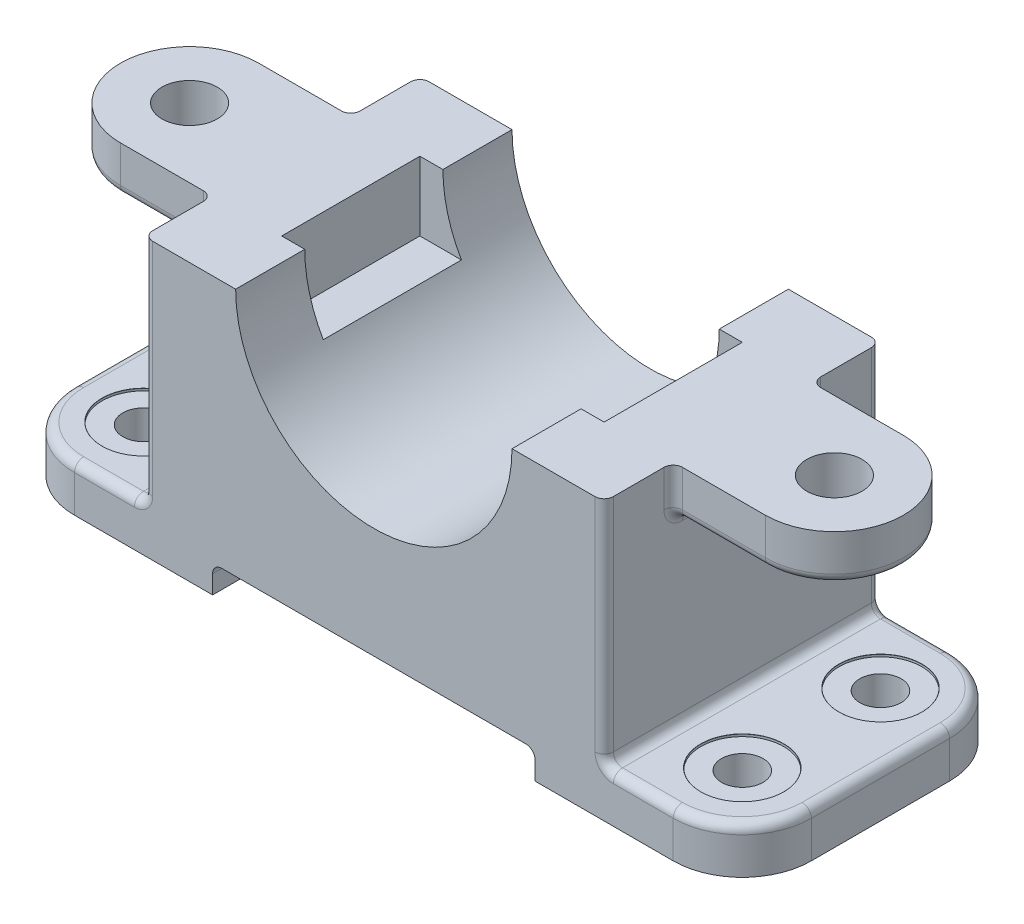
from build123d import *

# Parameters (mm, degrees)
EXTRUDE_1_DEPTH             = 60
SKETCH_2_R                  = 6
EXTRUDE_2_DEPTH             = 10
FILLET_1_R                  = 15
HOLE_WIZARD_M8_1_AT_2_COUNT = 2
HOLE_WIZARD_M8_1_AT_2_PITCH = 30
HOLE_WIZARD_M8_1_AT_3_COUNT = 2
HOLE_WIZARD_M8_1_AT_3_PITCH = 130
HOLE_WIZARD_M8_1_AT_4_COUNT = 2
HOLE_WIZARD_M8_1_AT_4_PITCH = 133.416640641
FILLET_2_R                  = 2
SKETCH_5_W                  = 70
SKETCH_5_H                  = 30
CUT_EXTRUDE_1_DEPTH         = 15


with BuildPart() as part:
    # 草图1 → 凸台-拉伸1 (new body)
    with BuildSketch(Plane.XY):
        with BuildLine():
            Line((35, 0), (-35, 0))
            Line((-35, 0), (-35, -6))
            Line((-35, -6), (-80, -6))
            Line((-80, -6), (-80, 4))
            Line((-80, 4), (-50, 4))
            Line((-50, 4), (-50, 54))
            Line((-50, 54), (-30, 54))
            ThreePointArc((-30, 54), (0, 24), (30, 54))
            Line((30, 54), (50, 54))
            Line((50, 54), (50, 4))
            Line((50, 4), (80, 4))
            Line((80, 4), (80, -6))
            Line((80, -6), (35, -6))
            Line((35, -6), (35, 0))
        make_face()
    extrude(amount=-EXTRUDE_1_DEPTH)

    # 草图2 → 凸台-拉伸2 (add)
    # profile 1 of 2: a face of its own
    with BuildSketch(Plane(origin=(0, 54, 0), x_dir=(1, 0, 0), z_dir=(0, 1, 0))):
        with BuildLine():
            Line((-50, 15), (-50, 45))
            Line((-50, 45), (-70, 45))
            ThreePointArc((-70, 45), (-85, 30), (-70, 15))
            Line((-70, 15), (-50, 15))
        make_face()
        with Locations(Location((-70, 30, 0), (0, 0, 270))):
            Circle(SKETCH_2_R, mode=Mode.SUBTRACT)
    # profile 2 of 2: a face of its own
    with BuildSketch(Plane(origin=(0, 54, 0), x_dir=(1, 0, 0), z_dir=(0, 1, 0))):
        with BuildLine():
            Line((50, 45), (70, 45))
            ThreePointArc((70, 45), (85, 30), (70, 15))
            Line((70, 15), (50, 15))
            Line((50, 15), (50, 45))
        make_face()
        with Locations(Location((70, 30, 0), (0, 0, 90))):
            Circle(SKETCH_2_R, mode=Mode.SUBTRACT)
    extrude(amount=-EXTRUDE_2_DEPTH)

    # 圆角1
    fillet_1_edges = [part.edges().sort_by_distance(p)[0] for p in [
        (-80, -1, 0),
        (80, -1, 0),
        (80, -1, -60),
        (-80, -1, -60),
    ]]
    fillet(fillet_1_edges, radius=FILLET_1_R)

    # 草图4 → M8 六角头螺栓的柱形沉头孔1 (revolve, cut)
    with BuildSketch(Plane(origin=(-65, 4, -15), x_dir=(0, 0, 1), z_dir=(1, 0, 0))):
        Polygon((0, 0), (0, 10), (4.5, 10), (4.5, 0.5), (9, 0.5), (9, 0.020977491), (9.025, 0), align=None)
    hole_wizard_m8_1 = revolve(axis=Axis((-65, 10.35, -15), (0, -1, 0)), mode=Mode.SUBTRACT)

    # M8 六角头螺栓的柱形沉头孔1 at 2: M8 六角头螺栓的柱形沉头孔1 ×2
    with Locations(*[(0, 0, -i * HOLE_WIZARD_M8_1_AT_2_PITCH) for i in range(1, HOLE_WIZARD_M8_1_AT_2_COUNT)]):
        add(hole_wizard_m8_1, mode=Mode.SUBTRACT)

    # M8 六角头螺栓的柱形沉头孔1 at 3: M8 六角头螺栓的柱形沉头孔1 ×2
    with Locations(*[(i * HOLE_WIZARD_M8_1_AT_3_PITCH, 0, 0) for i in range(1, HOLE_WIZARD_M8_1_AT_3_COUNT)]):
        add(hole_wizard_m8_1, mode=Mode.SUBTRACT)

    # M8 六角头螺栓的柱形沉头孔1 at 4: M8 六角头螺栓的柱形沉头孔1 ×2
    with Locations(*[Vector(0.9743911956946198, 0, -0.22485950669875843) * (i * HOLE_WIZARD_M8_1_AT_4_PITCH) for i in range(1, HOLE_WIZARD_M8_1_AT_4_COUNT)]):
        add(hole_wizard_m8_1, mode=Mode.SUBTRACT)

    # 圆角2
    fillet_2_edges = [part.edges().sort_by_distance(p)[0] for p in [
        (-57.5, 4, 0),
        (-50, 29, 0),
        (50, 29, 0),
        (-50, 4, -30),
        (50, 4, -30),
        (35, 0, -30),
        (-35, 0, -30),
        (50, 29, -60),
        (-60, 44, -15),
        (-50, 49, -15),
        (-85, 44, -30),
        (-60, 44, -45),
        (-50, 44, -30),
        (-50, 49, -45),
        (-50, 29, -60),
        (-57.5, 4, -60),
        (85, 44, -30),
        (60, 44, -15),
        (50, 44, -30),
        (50, 49, -15),
        (60, 44, -45),
        (50, 49, -45),
        (80, 4, -30),
        (57.5, 4, 0),
        (57.5, 4, -60),
        (75.606601718, 4, -4.393398282),
        (75.606601718, 4, -55.606601718),
        (-80, 4, -30),
        (-75.606601718, 4, -4.393398282),
        (-75.606601718, 4, -55.606601718),
    ]]
    fillet(fillet_2_edges, radius=FILLET_2_R)

    # 草图5 → 切除-拉伸1 (cut)
    with BuildSketch(Plane(origin=(0, 54, 0), x_dir=(1, 0, 0), z_dir=(0, 1, 0))):
        with Locations((0, 30)):
            Rectangle(SKETCH_5_W, SKETCH_5_H)
    extrude(amount=-CUT_EXTRUDE_1_DEPTH, mode=Mode.SUBTRACT)


solid = part.part
